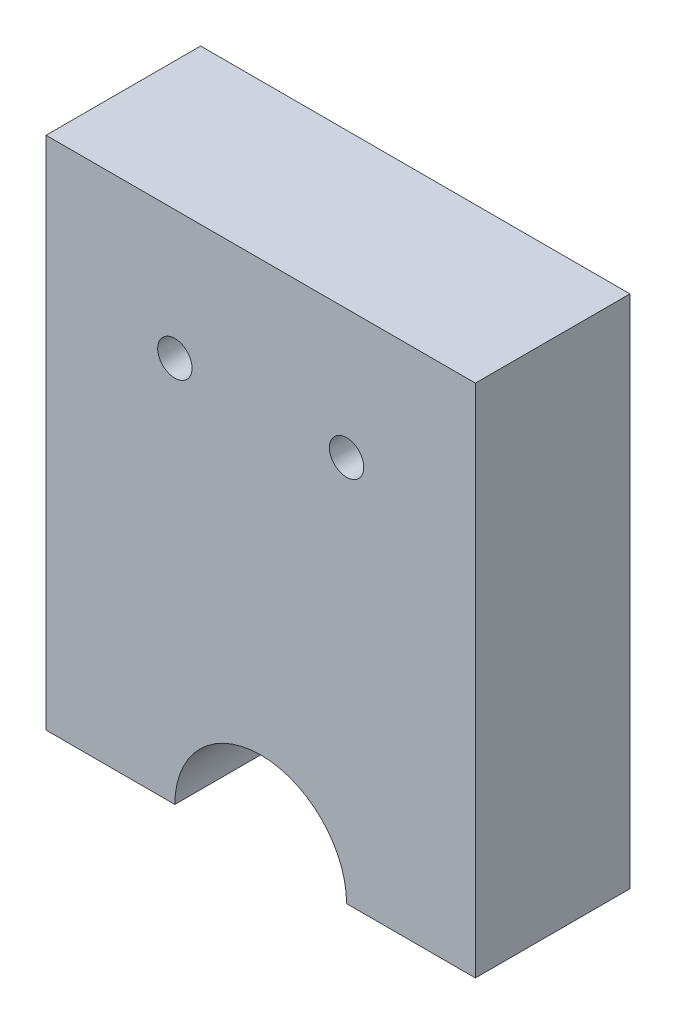
from build123d import *

# Parameters (mm, degrees)
SKETCH1_W           = 25
SKETCH1_H           = 30
BOSS_EXTRUDE1_DEPTH = 9
CUT_EXTRUDE3_DEPTH  = 41.074929819
SKETCH5_R           = 1
CUT_EXTRUDE4_DEPTH  = 41.074929819


with BuildPart() as part:
    # Sketch1 → Boss-Extrude1 (new body)
    with BuildSketch(Plane.XY):
        with Locations((12.5, 15)):
            Rectangle(SKETCH1_W, SKETCH1_H)
    extrude(amount=BOSS_EXTRUDE1_DEPTH)

    # Sketch4 → Cut-Extrude3 (cut, through all)
    with BuildSketch(Plane.XY.offset(9)):
        with BuildLine():
            ThreePointArc((17.5, 0), (12.5, 5), (7.5, 0))
            Line((7.5, 0), (17.5, 0))
        make_face()
        with BuildLine():
            Line((17.5, 0), (7.5, 0))
            ThreePointArc((7.5, 0), (12.5, -5), (17.5, 0))
        make_face()
    extrude(amount=-CUT_EXTRUDE3_DEPTH, mode=Mode.SUBTRACT)

    # Sketch5 → Cut-Extrude4 (cut, through all)
    with BuildSketch(Plane.XY.offset(9)):
        with Locations((7.5, 22.5)):
            Circle(SKETCH5_R)
        with Locations(Location((17.5, 22.5, 0), (0, 0, 180))):
            Circle(SKETCH5_R)
    extrude(amount=-CUT_EXTRUDE4_DEPTH, mode=Mode.SUBTRACT)


solid = part.part
